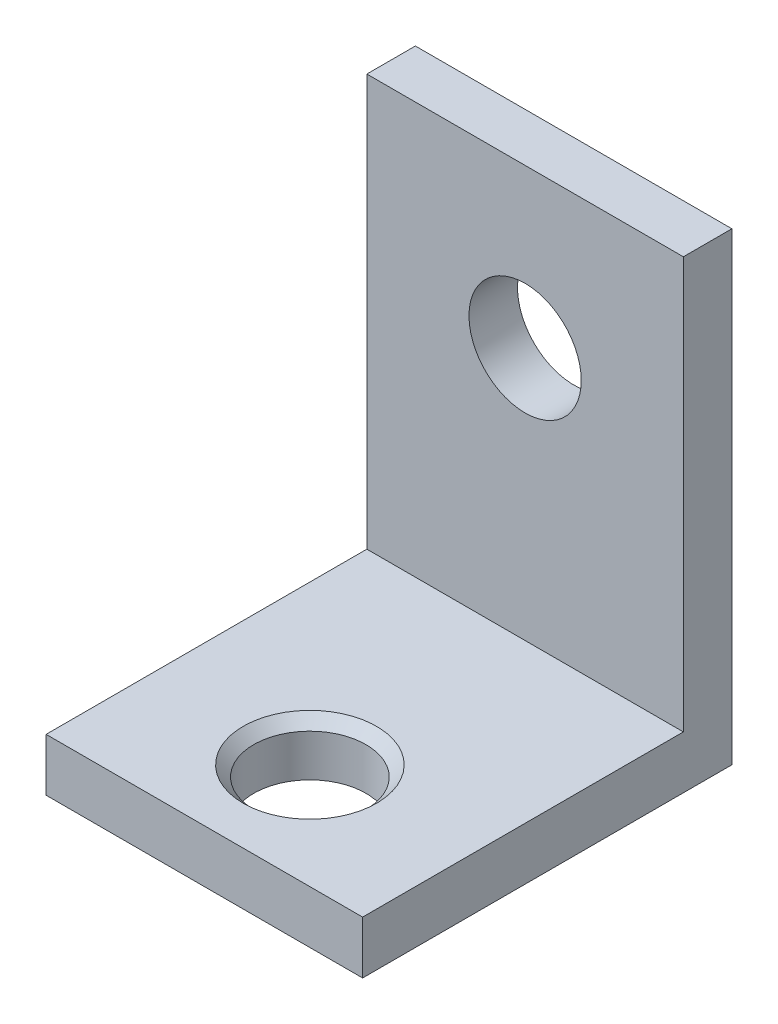
from build123d import *

# Parameters (mm, degrees)
SKETCH1_W               = 19.05
SKETCH1_H               = 22.225
BOSS_EXTRUDE1_DEPTH     = 3.175
SKETCH2_W               = 19.05
SKETCH2_H               = 3.175
BOSS_EXTRUDE2_DEPTH     = 24.765
F_1_4_CLEARANCE_HOLE3_D = 6.7564
MOVE_FACE1_BY           = 0.254


with BuildPart() as part:
    # Sketch1 → Boss-Extrude1 (new body)
    with BuildSketch(Plane(origin=(0, 0, 0), x_dir=(1, 0, 0), z_dir=(0, 1, 0))):
        with Locations((9.525, 11.1125)):
            Rectangle(SKETCH1_W, SKETCH1_H)
    extrude(amount=BOSS_EXTRUDE1_DEPTH)

    # Sketch2 → Boss-Extrude2 (add)
    with BuildSketch(Plane(origin=(0, 3.175, 0), x_dir=(1, 0, 0), z_dir=(0, 1, 0))):
        with Locations((9.525, 20.6375)):
            Rectangle(SKETCH2_W, SKETCH2_H)
    extrude(amount=BOSS_EXTRUDE2_DEPTH)

    # Sketch7 → 1/4 Clearance Hole2 (revolve, cut)
    with BuildSketch(Plane(origin=(9.525, 3.175, -6.35), x_dir=(0, 0, 1), z_dir=(1, 0, 0))):
        Polygon((0, 0), (0, 3.175), (3.3782, 3.175), (3.3782, 0.635), (4.0132, 0), align=None)
    revolve(axis=Axis((9.525, 9.525, -6.35), (0, -1, 0)), mode=Mode.SUBTRACT)

    # 1/4 Clearance Hole3 (through all)
    with Locations(Plane(origin=(9.525, 18.415, -19.05), x_dir=(1, 0, 0), z_dir=(0, 0, 1))):
        with Locations((0, 0)):
            Hole(F_1_4_CLEARANCE_HOLE3_D / 2)

    # Move Face1: a face moved inward by 0.254
    extrude(part.faces().sort_by_distance((9.525, 9.36625, -19.05))[0], amount=MOVE_FACE1_BY, dir=(0, 0, -1), mode=Mode.SUBTRACT)


solid = part.part
